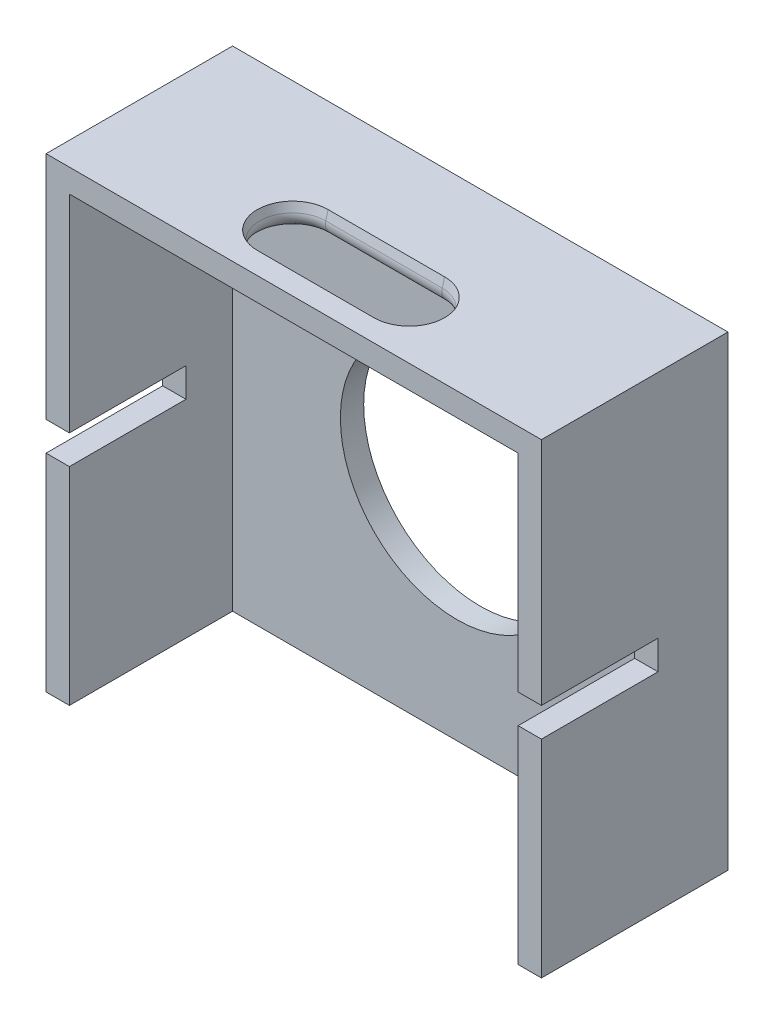
from build123d import *

# Parameters (mm, degrees)
SKETCH1_W                = 38.5
SKETCH1_H                = 38
SKETCH1_R                = 10
BOSS_EXTRUDE1_DEPTH      = 2
BOSS_EXTRUDE2_DEPTH      = 14
BOSS_EXTRUDE2_DEPTH_BACK = 2
CUT_EXTRUDE1_REACH       = 50.345
SKETCH3_W                = 10
SKETCH3_H                = 2.5
CUT_EXTRUDE2_DEPTH       = 47.384938288
CUT_EXTRUDE2_DRAFT       = 15
FILLET1_R                = 1


with BuildPart() as part:
    # Sketch1 → Boss-Extrude1 (new body)
    with BuildSketch(Plane.XY):
        Rectangle(SKETCH1_W, SKETCH1_H)
        Circle(SKETCH1_R, mode=Mode.SUBTRACT)
    extrude(amount=BOSS_EXTRUDE1_DEPTH)

    # Sketch2 → Boss-Extrude2 (add, two sides: drawn at the far end of the back side and taken through both)
    with BuildSketch(Plane.XY.offset(2).offset(-BOSS_EXTRUDE2_DEPTH_BACK)):
        Polygon((-21.25, -19), (-19.25, -19), (-19.25, 19), (19.25, 19), (19.25, -19), (21.25, -19), (21.25, 21), (-21.25, 21), align=None)
    extrude(amount=BOSS_EXTRUDE2_DEPTH + BOSS_EXTRUDE2_DEPTH_BACK)

    # Sketch3 → Cut-Extrude1 (cut, up to next)
    with BuildSketch(Plane(origin=(-19.25, 0, 0), x_dir=(0, 0, -1), z_dir=(1, 0, 0)), mode=Mode.PRIVATE) as cut_extrude1_sk1:
        with Locations((-11, 0)):
            Rectangle(SKETCH3_W, SKETCH3_H)
    cut_extrude1_tool1 = extrude(cut_extrude1_sk1.sketch, amount=-CUT_EXTRUDE1_REACH, mode=Mode.PRIVATE) & part.part
    cut_extrude1 = cut_extrude1_tool1.solids().sort_by_distance((-19.25, 0, 11))[0]
    add(cut_extrude1, mode=Mode.SUBTRACT)

    # Mirror1: Cut-Extrude1 across plane
    add(cut_extrude1.mirror(Plane(origin=(0, 0, 0), x_dir=(0, 0, 1), z_dir=(1, 0, 0))), mode=Mode.SUBTRACT)


with BuildPart() as cut_extrude2_tool:
    # Sketch5 → Cut-Extrude2 (with draft: the straight prism first)
    with BuildSketch(Plane.XZ.offset(-19)):
        with BuildLine():
            ThreePointArc((-5, 13.591034656), (-7.5, 11.091034656), (-5, 8.591034656))
            Line((-5, 8.591034656), (5, 8.591034656))
            ThreePointArc((5, 8.591034656), (7.5, 11.091034656), (5, 13.591034656))
            Line((5, 13.591034656), (-5, 13.591034656))
        make_face()
    extrude(amount=-CUT_EXTRUDE2_DEPTH)
    # Cut-Extrude2: the draft: its side faces are tilted about the plane it starts from
    cut_extrude2_sides = [cut_extrude2_tool.faces().sort_by_distance(p)[0] for p in [
        (-7.5, 42.692469144, 11.091034656),
        (0, 42.692469144, 8.591034656),
        (7.5, 42.692469144, 11.091034656),
        (0, 42.692469144, 13.591034656),
    ]]
    draft(cut_extrude2_sides, Plane.XZ.offset(-19), CUT_EXTRUDE2_DRAFT)


with BuildPart() as part_1:
    add(part.part)

    # Cut-Extrude2: cut by cut_extrude2_tool
    add(cut_extrude2_tool.part, mode=Mode.SUBTRACT)

    # Fillet1
    fillet1_edges = [part_1.edges().sort_by_distance(p)[0] for p in [
        (-7.5, 19, 11.091034656),
        (0, 19, 8.591034656),
        (7.5, 19, 11.091034656),
        (0, 19, 13.591034656),
    ]]
    fillet(fillet1_edges, radius=FILLET1_R)


solid = part_1.part
